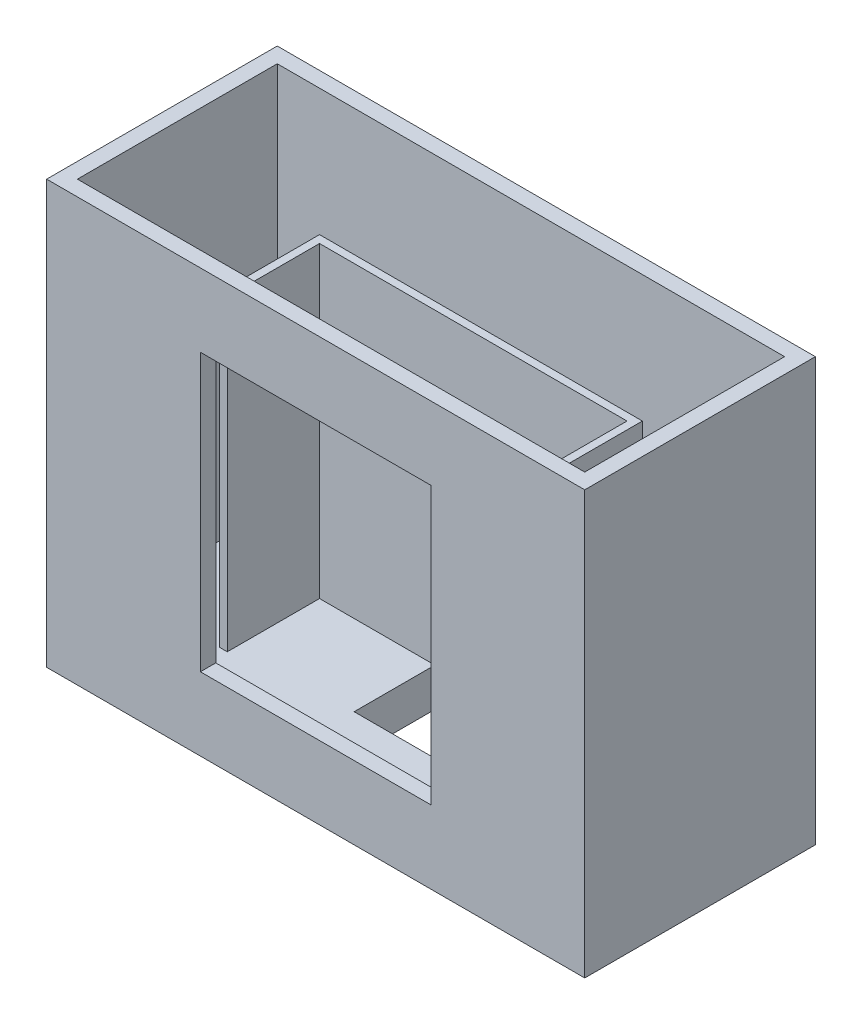
from build123d import *

# Parameters (mm, degrees)
SKETCH1_W           = 70
SKETCH1_H           = 30
BOSS_EXTRUDE1_DEPTH = 5
SKETCH2_W           = 70
SKETCH2_H           = 2
BOSS_EXTRUDE2_DEPTH = 50
SKETCH3_W           = 2
SKETCH3_H           = 26
BOSS_EXTRUDE3_DEPTH = 50
SKETCH4_W           = 42
SKETCH4_H           = 13
SKETCH4_W_2         = 40
SKETCH4_H_2         = 11
BOSS_EXTRUDE4_DEPTH = 40
SKETCH6_W           = 40
SKETCH6_H           = 40
CUT_EXTRUDE1_DEPTH  = 2
SKETCH7_W           = 15
SKETCH7_H           = 18
CUT_EXTRUDE2_DEPTH  = 5
SKETCH8_W           = 10
SKETCH8_H           = 10
CUT_EXTRUDE3_DEPTH  = 5


with BuildPart() as part:
    # Sketch1 → Boss-Extrude1 (new body)
    with BuildSketch(Plane(origin=(0, 0, 0), x_dir=(1, 0, 0), z_dir=(0, 1, 0))):
        Rectangle(SKETCH1_W, SKETCH1_H)
    extrude(amount=BOSS_EXTRUDE1_DEPTH)

    # Sketch2 → Boss-Extrude2 (add)
    with BuildSketch(Plane(origin=(0, 5, 0), x_dir=(1, 0, 0), z_dir=(0, 1, 0))):
        with Locations((0, -14)):
            Rectangle(SKETCH2_W, SKETCH2_H)
        with Locations((0, 14)):
            Rectangle(SKETCH2_W, SKETCH2_H)
    extrude(amount=BOSS_EXTRUDE2_DEPTH)

    # Sketch3 → Boss-Extrude3 (add)
    with BuildSketch(Plane(origin=(0, 5, 0), x_dir=(1, 0, 0), z_dir=(0, 1, 0))):
        with Locations((-34, 0)):
            Rectangle(SKETCH3_W, SKETCH3_H)
        with Locations((34, 0)):
            Rectangle(SKETCH3_W, SKETCH3_H)
    extrude(amount=BOSS_EXTRUDE3_DEPTH)

    # Sketch4 → Boss-Extrude4 (add)
    with BuildSketch(Plane(origin=(0, 5, 0), x_dir=(1, 0, 0), z_dir=(0, 1, 0))):
        Rectangle(SKETCH4_W, SKETCH4_H)
        Rectangle(SKETCH4_W_2, SKETCH4_H_2, mode=Mode.SUBTRACT)
    extrude(amount=BOSS_EXTRUDE4_DEPTH)

    # Sketch6 → Cut-Extrude1 (cut)
    with BuildSketch(Plane.XY.offset(6.5)):
        with Locations((0, 25)):
            Rectangle(SKETCH6_W, SKETCH6_H)
    extrude(amount=-CUT_EXTRUDE1_DEPTH, mode=Mode.SUBTRACT)

    # Sketch7 → Cut-Extrude2 (cut)
    with BuildSketch(Plane.XY.offset(15)):
        with Locations((-7.5, 36.5)):
            Rectangle(SKETCH7_W, SKETCH7_H)
        with Locations((7.5, 36.5)):
            Rectangle(SKETCH7_W, SKETCH7_H)
        with Locations((7.5, 18.5)):
            Rectangle(SKETCH7_W, SKETCH7_H)
        with Locations((-7.5, 18.5)):
            Rectangle(SKETCH7_W, SKETCH7_H)
    extrude(amount=-CUT_EXTRUDE2_DEPTH, mode=Mode.SUBTRACT)

    # Sketch8 → Cut-Extrude3 (cut)
    with BuildSketch(Plane.XZ):
        Rectangle(SKETCH8_W, SKETCH8_H)
    extrude(amount=-CUT_EXTRUDE3_DEPTH, mode=Mode.SUBTRACT)


solid = part.part
